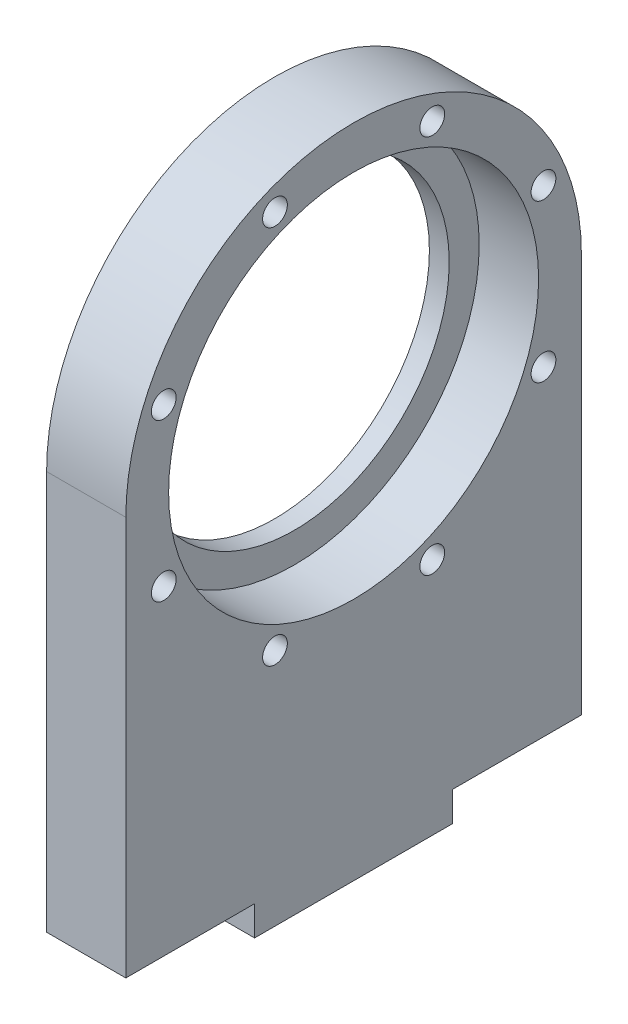
from build123d import *

# Parameters (mm, degrees)
SKETCH_1_R          = 18.68
SKETCH_1_R_2        = 15.652173913
EXTRUDE_2_DEPTH     = 2
SKETCH_1_4_R        = 23
SKETCH_1_4_R_2      = 1.25
SKETCH_1_4_R_3      = 18.68
EXTRUDE_3_DEPTH     = 8
EXTRUDE_4_DEPTH     = 8
SKETCH_3_R          = 1.8
CUT_EXTRUDE_1_DEPTH = 5
SKETCH_4_W          = 8
SKETCH_4_H          = 20
EXTRUDE_5_DEPTH     = 3


with BuildPart() as part:
    # 草图1 → 凸台-拉伸2 (new body)
    with BuildSketch(Plane(origin=(0, 0, 0), x_dir=(0, 0, -1), z_dir=(1, 0, 0))):
        Circle(SKETCH_1_R)
        Circle(SKETCH_1_R_2, mode=Mode.SUBTRACT)
    extrude(amount=EXTRUDE_2_DEPTH)

    # 草图1<4> → 凸台-拉伸3 (add)
    with BuildSketch(Plane(origin=(0, 0, 0), x_dir=(0, 0, -1), z_dir=(1, 0, 0))):
        Circle(SKETCH_1_4_R)
        with Locations((-7.940681222, -19.1705003)):
            Circle(SKETCH_1_4_R_2, mode=Mode.SUBTRACT)
        with Locations((-19.1705003, -7.940681222)):
            Circle(SKETCH_1_4_R_2, mode=Mode.SUBTRACT)
        with Locations((7.940681222, -19.1705003)):
            Circle(SKETCH_1_4_R_2, mode=Mode.SUBTRACT)
        with Locations((19.1705003, -7.940681222)):
            Circle(SKETCH_1_4_R_2, mode=Mode.SUBTRACT)
        with Locations((-19.1705003, 7.940681222)):
            Circle(SKETCH_1_4_R_2, mode=Mode.SUBTRACT)
        with Locations((-7.940681222, 19.1705003)):
            Circle(SKETCH_1_4_R_2, mode=Mode.SUBTRACT)
        Circle(SKETCH_1_4_R_3, mode=Mode.SUBTRACT)
        with Locations((19.1705003, 7.940681222)):
            Circle(SKETCH_1_4_R_2, mode=Mode.SUBTRACT)
        with Locations((7.940681222, 19.1705003)):
            Circle(SKETCH_1_4_R_2, mode=Mode.SUBTRACT)
    extrude(amount=EXTRUDE_3_DEPTH)

    # 草图2 → 凸台-拉伸4 (add)
    with BuildSketch(Plane.ZY):
        with BuildLine():
            Line((-23, -40.29), (-23, 0))
            ThreePointArc((-23, 0), (0, -23), (23, 0))
            Line((23, 0), (23, -40.29))
            Line((23, -40.29), (-23, -40.29))
        make_face()
    extrude(amount=-EXTRUDE_4_DEPTH)

    # 草图3 → 切除-拉伸1 (cut)
    with BuildSketch(Plane.XZ.offset(40.29)):
        with Locations((4, 19)):
            Circle(SKETCH_3_R)
    cut_extrude_1 = extrude(amount=-CUT_EXTRUDE_1_DEPTH, mode=Mode.SUBTRACT)

    # 镜向1: 切除-拉伸1 across plane
    add(cut_extrude_1.mirror(Plane(origin=(0, 0, 0), x_dir=(1, 0, 0), z_dir=(0, 0, -1))), mode=Mode.SUBTRACT)

    # 草图4 → 凸台-拉伸5 (add)
    with BuildSketch(Plane(origin=(0, -40.29, 0), x_dir=(-1, 0, 0), z_dir=(0, -1, 0))):
        with Locations((-4, 0)):
            Rectangle(SKETCH_4_W, SKETCH_4_H)
    extrude(amount=EXTRUDE_5_DEPTH)


solid = part.part
